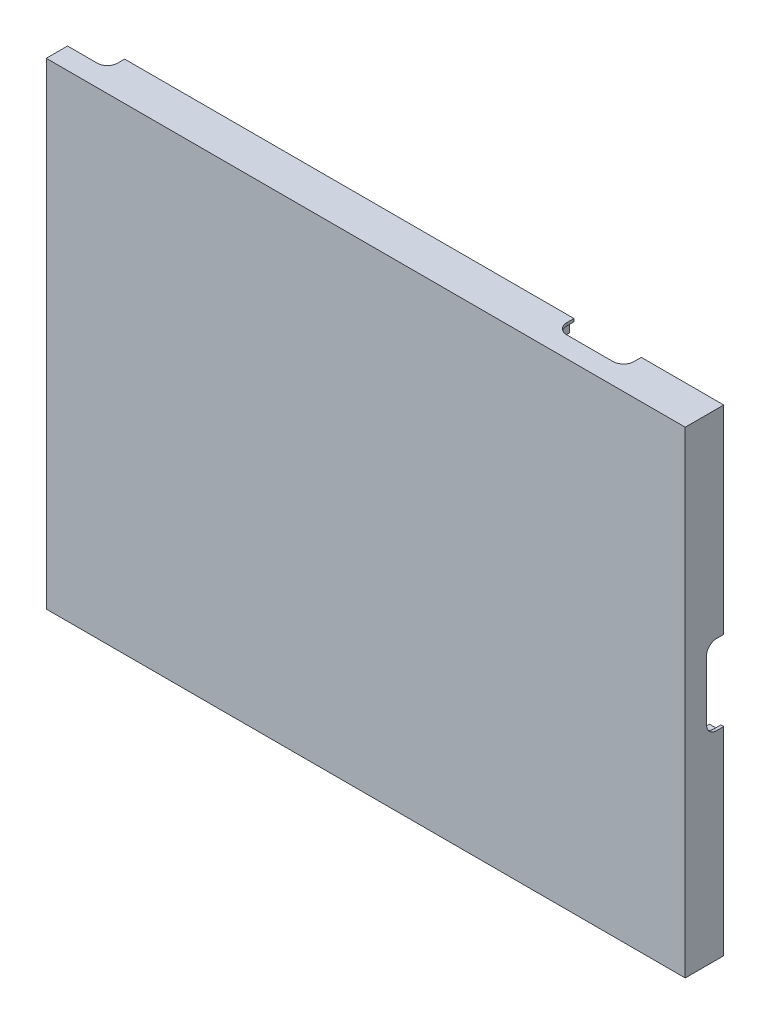
from build123d import *

# Parameters (mm, degrees)
BOSS_EXTRUDE1_START  = 3.25
SKETCH1_W            = 176
SKETCH1_H            = 126
BOSS_EXTRUDE1_DEPTH  = 6
CUT_EXTRUDE1_START   = 3.25
SKETCH1_2_W          = 176
SKETCH1_2_H          = 126
CUT_EXTRUDE1_DEPTH   = 3
BOSS_EXTRUDE2_DEPTH  = 2.6
BOSS_EXTRUDE3_DEPTH  = 0.7
BOSS_EXTRUDE4_START  = 3.3
BOSS_EXTRUDE4_DEPTH  = 1
BOSS_EXTRUDE5_DEPTH  = 2.55
BOSS_EXTRUDE6_DEPTH  = 0.7
BOSS_EXTRUDE7_START  = 3.25
BOSS_EXTRUDE7_DEPTH  = 1
BOSS_EXTRUDE8_START  = 2.5625
BOSS_EXTRUDE8_DEPTH  = 2.5625
BOSS_EXTRUDE9_START  = 0.7
BOSS_EXTRUDE9_DEPTH  = 0.7
BOSS_EXTRUDE10_START = 3.2625
BOSS_EXTRUDE10_DEPTH = 1
CUT_EXTRUDE2_START   = -6.5116
SKETCH8_W            = 21.4
SKETCH8_H            = 3.5
SKETCH8_W_2          = 12.7
SKETCH8_W_3          = 3.45
SKETCH8_H_2          = 25.4
SKETCH8_H_3          = 3.4625
CUT_EXTRUDE2_DEPTH   = 6.5116
CUT_EXTRUDE3_REACH   = 194.71
SKETCH9_W            = 176
SKETCH9_H            = 0.2
SKETCH10_R           = 4
SKETCH10_R_2         = 2.1
SKETCH10_R_3         = 3.25
BOSS_EXTRUDE11_DEPTH = 4.25
SKETCH11_W           = 114.1
SKETCH11_H           = 3
SKETCH11_W_2         = 3
SKETCH11_H_2         = 21.3
SKETCH11_H_3         = 14.85
SKETCH11_H_4         = 42.5
SKETCH11_W_3         = 74.5
SKETCH11_W_4         = 44.6
BOSS_EXTRUDE12_DEPTH = 4.25
CHAMFER1_SIZE        = 4.2


with BuildPart() as part:
    # Sketch1 → Boss-Extrude1 (new body)
    with BuildSketch(Plane.XY.offset(BOSS_EXTRUDE1_START)):
        with Locations((88, 0)):
            Rectangle(SKETCH1_W, SKETCH1_H)
    extrude(amount=BOSS_EXTRUDE1_DEPTH)

    # Sketch1<2> → Cut-Extrude1 (cut)
    with BuildSketch(Plane.XY.offset(CUT_EXTRUDE1_START)):
        with Locations((88, 0)):
            Rectangle(SKETCH1_2_W, SKETCH1_2_H)
    extrude(amount=CUT_EXTRUDE1_DEPTH, mode=Mode.SUBTRACT)

    # Sketch2 → Boss-Extrude2 (add)
    with BuildSketch(Plane(origin=(0, 63, 0), x_dir=(1, 0, 0), z_dir=(0, 1, 0))):
        with BuildLine():
            Line((0, -3.25), (0, -9.25))
            Line((0, -9.25), (176, -9.25))
            Line((176, -9.25), (176, 1.6116))
            Line((176, 1.6116), (157, 1.6116))
            Line((157, 1.6116), (157, -0.4))
            ThreePointArc((157, -0.4), (156.121320344, -2.521320344), (154, -3.4))
            Line((154, -3.4), (141, -3.4))
            ThreePointArc((141, -3.4), (138.878679656, -2.521320344), (138, -0.4))
            Line((138, -0.4), (138, 1.6116))
            Line((138, 1.6116), (11.25, 1.6116))
            Line((11.25, 1.6116), (11.25, -0.4))
            ThreePointArc((11.25, -0.4), (10.415254326, -2.415254326), (8.4, -3.25))
            Line((8.4, -3.25), (0, -3.25))
        make_face()
    extrude(amount=BOSS_EXTRUDE2_DEPTH)

    # Sketch3 → Boss-Extrude3 (add)
    with BuildSketch(Plane(origin=(0, 65.6, 0), x_dir=(1, 0, 0), z_dir=(0, 1, 0))):
        with BuildLine():
            Line((0, -4.4), (0, -9.25))
            Line((0, -9.25), (176, -9.25))
            Line((176, -9.25), (176, 1.6116))
            Line((176, 1.6116), (157.457378406, 1.6116))
            ThreePointArc((157.457378406, 1.6116), (157.46744863, -2.394191566), (154, -4.4))
            Line((154, -4.4), (141, -4.4))
            ThreePointArc((141, -4.4), (137.53255137, -2.394191566), (137.542621594, 1.6116))
            Line((137.542621594, 1.6116), (11.957378406, 1.6116))
            ThreePointArc((11.957378406, 1.6116), (11.96744863, -2.394191566), (8.5, -4.4))
            Line((8.5, -4.4), (0, -4.4))
        make_face()
    extrude(amount=BOSS_EXTRUDE3_DEPTH)

    # Sketch2<3> → Boss-Extrude4 (add)
    with BuildSketch(Plane(origin=(0, 63, 0), x_dir=(1, 0, 0), z_dir=(0, 1, 0)).offset(BOSS_EXTRUDE4_START)):
        with BuildLine():
            Line((0, -3.25), (0, -9.25))
            Line((0, -9.25), (176, -9.25))
            Line((176, -9.25), (176, 1.6116))
            Line((176, 1.6116), (157, 1.6116))
            Line((157, 1.6116), (157, -0.4))
            ThreePointArc((157, -0.4), (156.121320344, -2.521320344), (154, -3.4))
            Line((154, -3.4), (141, -3.4))
            ThreePointArc((141, -3.4), (138.878679656, -2.521320344), (138, -0.4))
            Line((138, -0.4), (138, 1.6116))
            Line((138, 1.6116), (11.25, 1.6116))
            Line((11.25, 1.6116), (11.25, -0.4))
            ThreePointArc((11.25, -0.4), (10.415254326, -2.415254326), (8.4, -3.25))
            Line((8.4, -3.25), (0, -3.25))
        make_face()
    extrude(amount=BOSS_EXTRUDE4_DEPTH)

    # Sketch4 → Boss-Extrude5 (add)
    with BuildSketch(Plane(origin=(176, 0, 0), x_dir=(0, 0, -1), z_dir=(1, 0, 0))):
        with BuildLine():
            Line((1.6116, 67.3), (-9.25, 67.3))
            Line((-9.25, 67.3), (-9.25, -63))
            Line((-9.25, -63), (1.6116, -63))
            Line((1.6116, -63), (1.6116, -11.25))
            Line((1.6116, -11.25), (-0.4, -11.25))
            ThreePointArc((-0.4, -11.25), (-2.415254326, -10.415254326), (-3.25, -8.4))
            Line((-3.25, -8.4), (-3.25, 8.4))
            ThreePointArc((-3.25, 8.4), (-2.415254326, 10.415254326), (-0.4, 11.25))
            Line((-0.4, 11.25), (1.6116, 11.25))
            Line((1.6116, 11.25), (1.6116, 67.3))
        make_face()
    extrude(amount=BOSS_EXTRUDE5_DEPTH)

    # Sketch5 → Boss-Extrude6 (add)
    with BuildSketch(Plane(origin=(178.55, 0, 0), x_dir=(0, 0, -1), z_dir=(1, 0, 0))):
        with BuildLine():
            Line((1.6116, 11.957378406), (1.6116, 67.3))
            Line((1.6116, 67.3), (-9.25, 67.3))
            Line((-9.25, 67.3), (-9.25, -63))
            Line((-9.25, -63), (1.6116, -63))
            Line((1.6116, -63), (1.6116, -11.957378406))
            ThreePointArc((1.6116, -11.957378406), (-2.394191566, -11.96744863), (-4.4, -8.5))
            Line((-4.4, -8.5), (-4.4, 8.5))
            ThreePointArc((-4.4, 8.5), (-2.394191566, 11.96744863), (1.6116, 11.957378406))
        make_face()
    extrude(amount=BOSS_EXTRUDE6_DEPTH)

    # Sketch4<3> → Boss-Extrude7 (add)
    with BuildSketch(Plane(origin=(176, 0, 0), x_dir=(0, 0, -1), z_dir=(1, 0, 0)).offset(BOSS_EXTRUDE7_START)):
        with BuildLine():
            Line((1.6116, 67.3), (-9.25, 67.3))
            Line((-9.25, 67.3), (-9.25, -63))
            Line((-9.25, -63), (1.6116, -63))
            Line((1.6116, -63), (1.6116, -11.25))
            Line((1.6116, -11.25), (-0.4, -11.25))
            ThreePointArc((-0.4, -11.25), (-2.415254326, -10.415254326), (-3.25, -8.4))
            Line((-3.25, -8.4), (-3.25, 8.4))
            ThreePointArc((-3.25, 8.4), (-2.415254326, 10.415254326), (-0.4, 11.25))
            Line((-0.4, 11.25), (1.6116, 11.25))
            Line((1.6116, 11.25), (1.6116, 67.3))
        make_face()
    extrude(amount=BOSS_EXTRUDE7_DEPTH)

    # Sketch6 → Boss-Extrude8 (add)
    with BuildSketch(Plane.XZ.offset(63).offset(BOSS_EXTRUDE8_START)):
        with BuildLine():
            Line((87.5, -1.6116), (180.25, -1.6116))
            Line((180.25, -1.6116), (180.25, 9.25))
            Line((180.25, 9.25), (0, 9.25))
            Line((0, 9.25), (0, 3.25))
            Line((0, 3.25), (8.4, 3.25))
            ThreePointArc((8.4, 3.25), (10.415254326, 2.415254326), (11.25, 0.4))
            Line((11.25, 0.4), (11.25, -1.6116))
            Line((11.25, -1.6116), (68.5, -1.6116))
            Line((68.5, -1.6116), (68.5, 0.4))
            ThreePointArc((68.5, 0.4), (69.378679656, 2.521320344), (71.5, 3.4))
            Line((71.5, 3.4), (84.5, 3.4))
            ThreePointArc((84.5, 3.4), (86.621320344, 2.521320344), (87.5, 0.4))
            Line((87.5, 0.4), (87.5, -1.6116))
        make_face()
    extrude(amount=-BOSS_EXTRUDE8_DEPTH)

    # Sketch7 → Boss-Extrude9 (add)
    with BuildSketch(Plane.XZ.offset(65.5625).offset(BOSS_EXTRUDE9_START)):
        with BuildLine():
            Line((87.957378406, -1.6116), (180.25, -1.6116))
            Line((180.25, -1.6116), (180.25, 9.25))
            Line((180.25, 9.25), (0, 9.25))
            Line((0, 9.25), (0, 4.4))
            Line((0, 4.4), (8.5, 4.4))
            ThreePointArc((8.5, 4.4), (11.96744863, 2.394191566), (11.957378406, -1.6116))
            Line((11.957378406, -1.6116), (68.042621594, -1.6116))
            ThreePointArc((68.042621594, -1.6116), (68.03255137, 2.394191566), (71.5, 4.4))
            Line((71.5, 4.4), (84.5, 4.4))
            ThreePointArc((84.5, 4.4), (87.96744863, 2.394191566), (87.957378406, -1.6116))
        make_face()
    extrude(amount=-BOSS_EXTRUDE9_DEPTH)

    # Sketch6<4> → Boss-Extrude10 (add)
    with BuildSketch(Plane.XZ.offset(63).offset(BOSS_EXTRUDE10_START)):
        with BuildLine():
            Line((87.5, -1.6116), (180.25, -1.6116))
            Line((180.25, -1.6116), (180.25, 9.25))
            Line((180.25, 9.25), (0, 9.25))
            Line((0, 9.25), (0, 3.25))
            Line((0, 3.25), (8.4, 3.25))
            ThreePointArc((8.4, 3.25), (10.415254326, 2.415254326), (11.25, 0.4))
            Line((11.25, 0.4), (11.25, -1.6116))
            Line((11.25, -1.6116), (68.5, -1.6116))
            Line((68.5, -1.6116), (68.5, 0.4))
            ThreePointArc((68.5, 0.4), (69.378679656, 2.521320344), (71.5, 3.4))
            Line((71.5, 3.4), (84.5, 3.4))
            ThreePointArc((84.5, 3.4), (86.621320344, 2.521320344), (87.5, 0.4))
            Line((87.5, 0.4), (87.5, -1.6116))
        make_face()
    extrude(amount=BOSS_EXTRUDE10_DEPTH)

    # Sketch8 → Cut-Extrude2 (cut)
    with BuildSketch(Plane(origin=(0, 0, -1.6116), x_dir=(-1, 0, 0), z_dir=(0, 0, -1)).offset(CUT_EXTRUDE2_START)):
        with Locations((-147.5, 64.75)):
            Rectangle(SKETCH8_W, SKETCH8_H)
        with Locations((-6.35, 64.75)):
            Rectangle(SKETCH8_W_2, SKETCH8_H)
        with Locations((-177.725, 0)):
            Rectangle(SKETCH8_W_3, SKETCH8_H_2)
        with Locations((-78, -64.73125)):
            Rectangle(SKETCH8_W, SKETCH8_H_3)
        with Locations((-6.35, -64.73125)):
            Rectangle(SKETCH8_W_2, SKETCH8_H_3)
    extrude(amount=CUT_EXTRUDE2_DEPTH, mode=Mode.SUBTRACT)

    # Cut-Extrude3: up to this face of the body (flat: up to its plane)
    cut_extrude3_end = Plane(part.part.faces().sort_by_distance((88, 0, 6.25))[0])
    # Sketch9 → Cut-Extrude3 (cut, up to the picked face)
    with BuildSketch(Plane(origin=(0, 0, -1.6116), x_dir=(-1, 0, 0), z_dir=(0, 0, -1)), mode=Mode.PRIVATE) as cut_extrude3_sk1:
        with Locations((-88, 63.1)):
            Rectangle(SKETCH9_W, SKETCH9_H)
    cut_extrude3_tool1 = split(extrude(cut_extrude3_sk1.sketch, amount=-CUT_EXTRUDE3_REACH, mode=Mode.PRIVATE), bisect_by=cut_extrude3_end, keep=Keep.BOTH, mode=Mode.PRIVATE)
    # Sketch9 → Cut-Extrude3 (cut, up to the picked face)
    with BuildSketch(Plane(origin=(0, 0, -1.6116), x_dir=(-1, 0, 0), z_dir=(0, 0, -1)), mode=Mode.PRIVATE) as cut_extrude3_sk2:
        Polygon((-176, -63), (-176, 63), (-176, 63.2), (-176.2, 63.2), (-176.2, -63), align=None)
    cut_extrude3_tool2 = split(extrude(cut_extrude3_sk2.sketch, amount=-CUT_EXTRUDE3_REACH, mode=Mode.PRIVATE), bisect_by=cut_extrude3_end, keep=Keep.BOTH, mode=Mode.PRIVATE)
    # Sketch9 → Cut-Extrude3 (cut, up to the picked face)
    with BuildSketch(Plane(origin=(0, 0, -1.6116), x_dir=(-1, 0, 0), z_dir=(0, 0, -1)), mode=Mode.PRIVATE) as cut_extrude3_sk3:
        Polygon((0, -63), (-176, -63), (-176.2, -63), (-176.2, -63.2), (0, -63.2), align=None)
    cut_extrude3_tool3 = split(extrude(cut_extrude3_sk3.sketch, amount=-CUT_EXTRUDE3_REACH, mode=Mode.PRIVATE), bisect_by=cut_extrude3_end, keep=Keep.BOTH, mode=Mode.PRIVATE)
    add(cut_extrude3_tool1.solids().sort_by(Axis((88, 63.1, -1.6116), (0, 0, 1)))[0], mode=Mode.SUBTRACT)
    add(cut_extrude3_tool2.solids().sort_by(Axis((176.1, 0.1, -1.6116), (0, 0, 1)))[0], mode=Mode.SUBTRACT)
    add(cut_extrude3_tool3.solids().sort_by(Axis((88.1, -63.1, -1.6116), (0, 0, 1)))[0], mode=Mode.SUBTRACT)

    # Sketch10 → Boss-Extrude11 (add)
    # profile 1 of 5: a face of its own
    with BuildSketch(Plane(origin=(0, 0, 6.25), x_dir=(-1, 0, 0), z_dir=(0, 0, -1))):
        with Locations((-144.5, 38)):
            Circle(SKETCH10_R)
        with Locations((-144.5, 38)):
            Circle(SKETCH10_R_2, mode=Mode.SUBTRACT)
    # profile 2 of 5: a face of its own
    with BuildSketch(Plane(origin=(0, 0, 6.25), x_dir=(-1, 0, 0), z_dir=(0, 0, -1))):
        with Locations((-60.5, 38)):
            Circle(SKETCH10_R)
        with Locations((-60.5, 38)):
            Circle(SKETCH10_R_2, mode=Mode.SUBTRACT)
    # profile 3 of 5: a face of its own
    with BuildSketch(Plane(origin=(0, 0, 6.25), x_dir=(-1, 0, 0), z_dir=(0, 0, -1))):
        with Locations((-73.5, -52)):
            Circle(SKETCH10_R)
        with Locations((-73.5, -52)):
            Circle(SKETCH10_R_2, mode=Mode.SUBTRACT)
    # profile 4 of 5: a face of its own
    with BuildSketch(Plane(origin=(0, 0, 6.25), x_dir=(-1, 0, 0), z_dir=(0, 0, -1))):
        with Locations((-11.25, -52)):
            Circle(SKETCH10_R)
        with Locations((-11.25, -52)):
            Circle(SKETCH10_R_2, mode=Mode.SUBTRACT)
    # profile 5 of 5: a face of its own
    with BuildSketch(Plane(origin=(0, 0, 6.25), x_dir=(-1, 0, 0), z_dir=(0, 0, -1))):
        with Locations((-143, -15)):
            Circle(SKETCH10_R_3)
        with Locations((-143, -15)):
            Circle(SKETCH10_R_2, mode=Mode.SUBTRACT)
    extrude(amount=BOSS_EXTRUDE11_DEPTH)

    # Sketch11 → Boss-Extrude12 (add)
    with BuildSketch(Plane(origin=(0, 0, 6.25), x_dir=(-1, 0, 0), z_dir=(0, 0, -1))):
        with Locations((-74.75, 61.7)):
            Rectangle(SKETCH11_W, SKETCH11_H)
        with Locations((-174.7, 52.55)):
            Rectangle(SKETCH11_W_2, SKETCH11_H_2)
        with Locations((-174.7, 25.125)):
            Rectangle(SKETCH11_W_2, SKETCH11_H_3)
        with Locations((-174.7, -38.95)):
            Rectangle(SKETCH11_W_2, SKETCH11_H_4)
        with Locations((-135.95, -61.7)):
            Rectangle(SKETCH11_W_3, SKETCH11_H)
        with Locations((-174.7, -61.7)):
            Rectangle(SKETCH11_W_2, SKETCH11_H)
        with Locations((-40, -61.7)):
            Rectangle(SKETCH11_W_4, SKETCH11_H)
    extrude(amount=BOSS_EXTRUDE12_DEPTH)

    # Chamfer1
    chamfer1_edges = [part.edges().sort_by_distance(p)[0] for p in [
        (146.25, -15, 6.25),
    ]]
    chamfer(chamfer1_edges, length=CHAMFER1_SIZE)


solid = part.part
